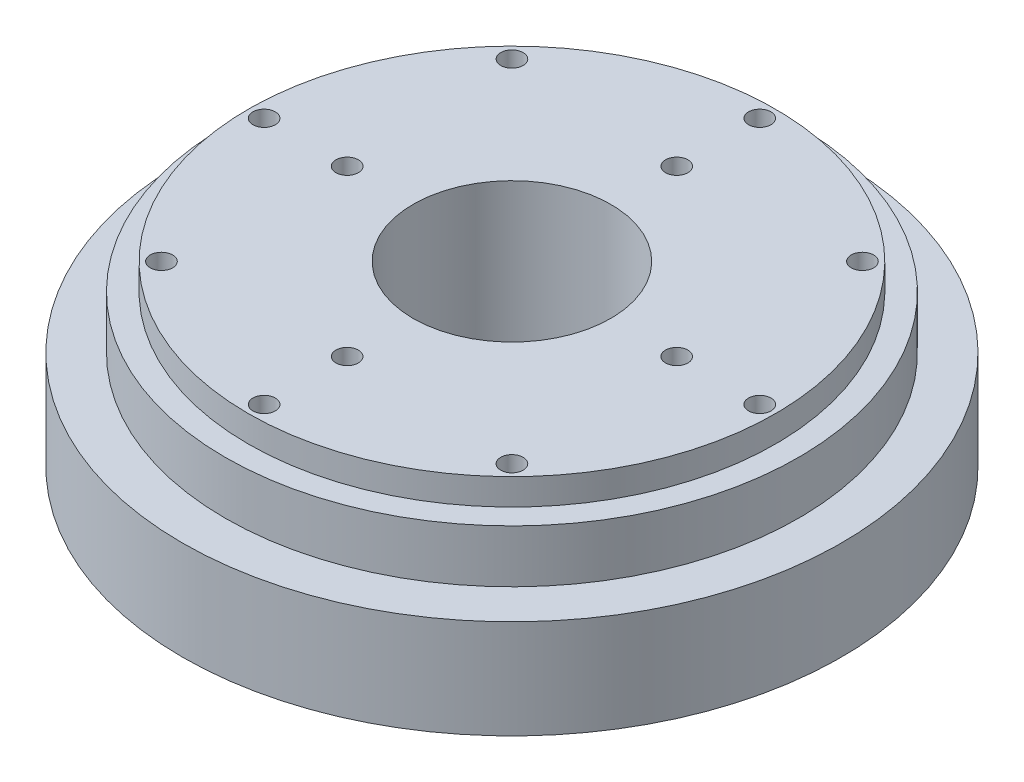
from build123d import *

# Parameters (mm, degrees)
CROQUIS1_R                       = 50
CROQUIS1_R_2                     = 15
SALIENTE_EXTRUIR1_DEPTH          = 15
CROQUIS2_R                       = 43.5
CROQUIS2_R_2                     = 15
SALIENTE_EXTRUIR2_DEPTH          = 8
CROQUIS3_R                       = 40
CROQUIS3_R_2                     = 15
SALIENTE_EXTRUIR3_DEPTH          = 4
TALADRO_DE_MARGEN_PARA_M31_D     = 3.4
TALADRO_DE_MARGEN_PARA_M31_DEPTH = 10
TALADRO_DE_MARGEN_PARA_M31_TIP   = 1.021463052
TALADRO_DE_MARGEN_PARA_M32_D     = 3.4
TALADRO_DE_MARGEN_PARA_M32_DEPTH = 20
TALADRO_DE_MARGEN_PARA_M32_TIP   = 1.021463052


with BuildPart() as part:
    # Croquis1 → Saliente-Extruir1 (new body)
    with BuildSketch(Plane(origin=(0, 0, 0), x_dir=(1, 0, 0), z_dir=(0, 1, 0))):
        with Locations(Location((0, 0, 0), (0, 0, 270))):
            Circle(CROQUIS1_R)
        with Locations(Location((0, 0, 0), (0, 0, 270))):
            Circle(CROQUIS1_R_2, mode=Mode.SUBTRACT)
    extrude(amount=SALIENTE_EXTRUIR1_DEPTH)

    # Croquis2 → Saliente-Extruir2 (add)
    with BuildSketch(Plane(origin=(0, 15, 0), x_dir=(1, 0, 0), z_dir=(0, 1, 0))):
        with Locations(Location((0, 0, 0), (0, 0, 270))):
            Circle(CROQUIS2_R)
        with Locations(Location((0, 0, 0), (0, 0, 270))):
            Circle(CROQUIS2_R_2, mode=Mode.SUBTRACT)
    extrude(amount=SALIENTE_EXTRUIR2_DEPTH)

    # Croquis3 → Saliente-Extruir3 (add)
    with BuildSketch(Plane(origin=(0, 23, 0), x_dir=(1, 0, 0), z_dir=(0, 1, 0))):
        with Locations(Location((0, 0, 0), (0, 0, 270))):
            Circle(CROQUIS3_R)
        with Locations(Location((0, 0, 0), (0, 0, 270))):
            Circle(CROQUIS3_R_2, mode=Mode.SUBTRACT)
    extrude(amount=SALIENTE_EXTRUIR3_DEPTH)

    # Taladro de margen para M31
    with Locations(Plane(origin=(0, 27, 0), x_dir=(1, 0, 0), z_dir=(0, 1, 0))):
        with Locations((0, 37.6), (26.587214973, 26.587214973), (37.6, 0), (26.587214973, -26.587214973), (0, -37.6), (-26.587214973, -26.587214973), (-37.6, 0), (-26.587214973, 26.587214973)):
            Hole(TALADRO_DE_MARGEN_PARA_M31_D / 2, depth=TALADRO_DE_MARGEN_PARA_M31_DEPTH)
            with Locations((0, 0, -(TALADRO_DE_MARGEN_PARA_M31_DEPTH + TALADRO_DE_MARGEN_PARA_M31_TIP / 2))):  # 118° drill point
                Cone(0, TALADRO_DE_MARGEN_PARA_M31_D / 2, TALADRO_DE_MARGEN_PARA_M31_TIP, mode=Mode.SUBTRACT)

    # Taladro de margen para M32
    with Locations(Plane(origin=(0, 27, 0), x_dir=(1, 0, 0), z_dir=(0, 1, 0))):
        with Locations((0, 25), (25, 0), (0, -25), (-25, 0)):
            Hole(TALADRO_DE_MARGEN_PARA_M32_D / 2, depth=TALADRO_DE_MARGEN_PARA_M32_DEPTH)
            with Locations((0, 0, -(TALADRO_DE_MARGEN_PARA_M32_DEPTH + TALADRO_DE_MARGEN_PARA_M32_TIP / 2))):  # 118° drill point
                Cone(0, TALADRO_DE_MARGEN_PARA_M32_D / 2, TALADRO_DE_MARGEN_PARA_M32_TIP, mode=Mode.SUBTRACT)


solid = part.part
